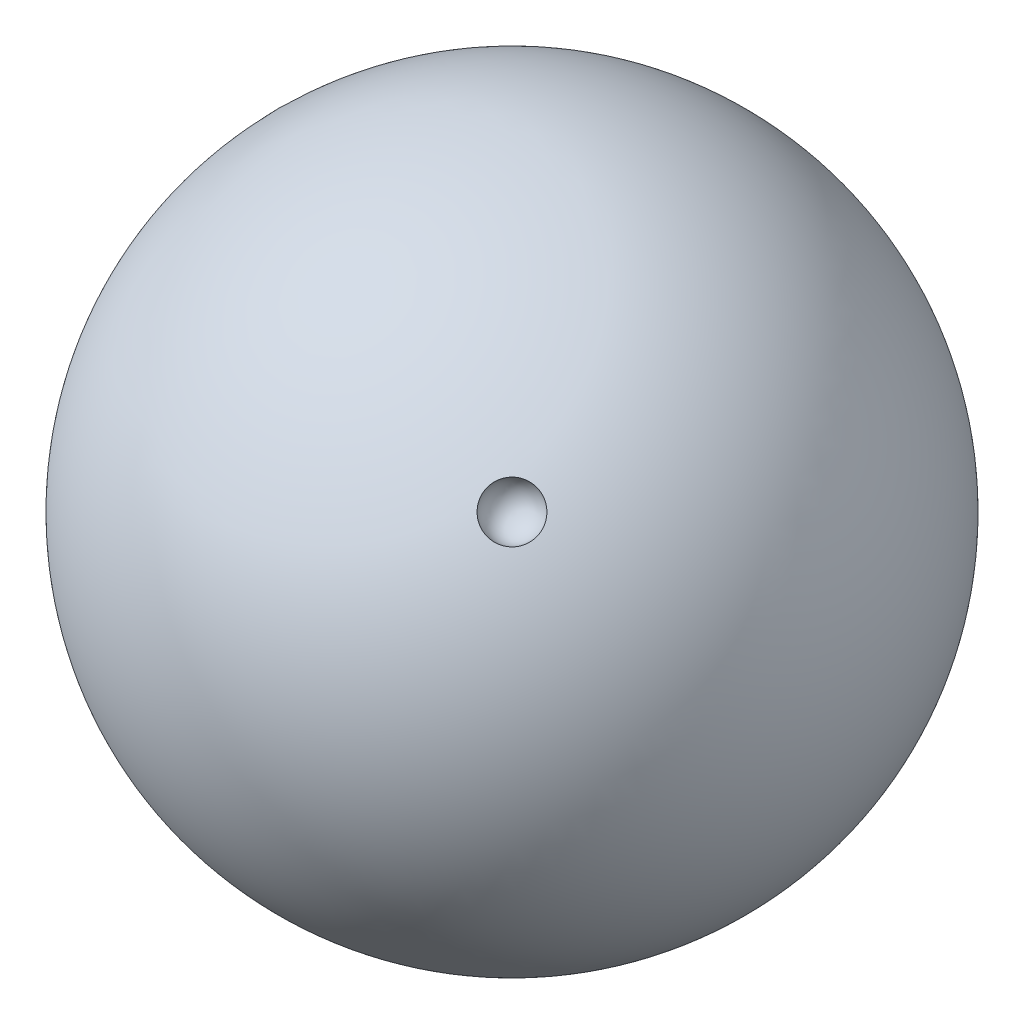
from build123d import *


with BuildPart() as part:
    # Sketch1 → Revolve1 (revolve)
    with BuildSketch(Plane.XY):
        with BuildLine():
            Line((0, 40), (0, -40))
            ThreePointArc((0, -40), (40, 0), (0, 40))
        make_face()
    revolve(axis=Axis((0, 0, 0), (0, 1, 0)))

    # Sketch3 → Cut-Revolve2 (revolve, cut)
    with BuildSketch(Plane(origin=(23.094010768, 23.094010768, 23.094010768), x_dir=(-0.4958264952019329, -0.3138848166461637, 0.8097113118481005), z_dir=(0.5773502691896258, 0.5773502691896278, 0.5773502691896238))):
        with BuildLine():
            Line((0, 3), (0, -3))
            ThreePointArc((0, -3), (3, 0), (0, 3))
        make_face()
    revolve(axis=Axis((23.094010768, 23.094010768, 23.094010768), (-0.6487085272465858, 0.7537526043375696, -0.1050440770909867)), mode=Mode.SUBTRACT)


solid = part.part
